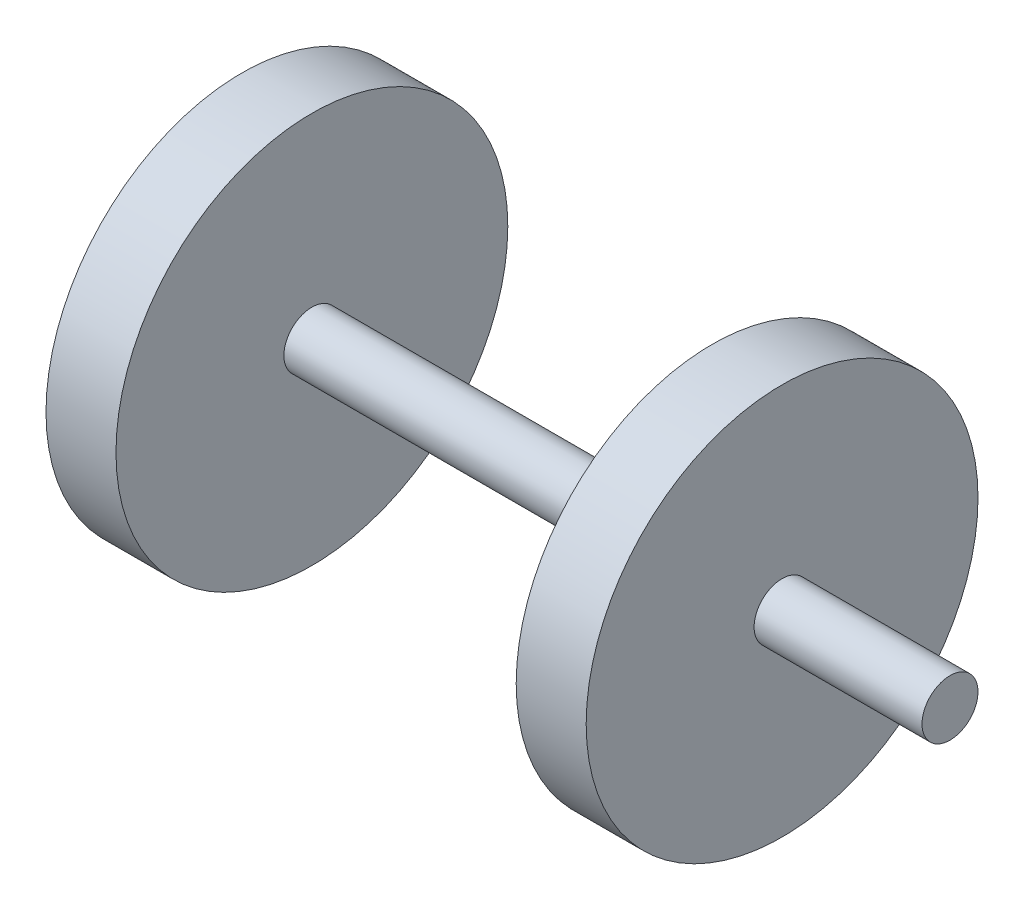
from build123d import *


with BuildPart() as part:
    # 草图1 → 旋转1 (revolve)
    with BuildSketch(Plane.XY, mode=Mode.PRIVATE) as revolve_1_sk:
        Polygon((12.5, 0), (84, 0), (126.5, 0), (126.5, 5), (96.5, 5), (96.5, 35), (84, 35), (84, 5), (12.5, 5), (12.5, 35), (0, 35), (0, 0), align=None)
    revolve(revolve_1_sk.sketch.rotate(Axis((12.5, 0, 0), (1, 0, 0)), 90), axis=Axis((12.5, 0, 0), (1, 0, 0)))


solid = part.part
